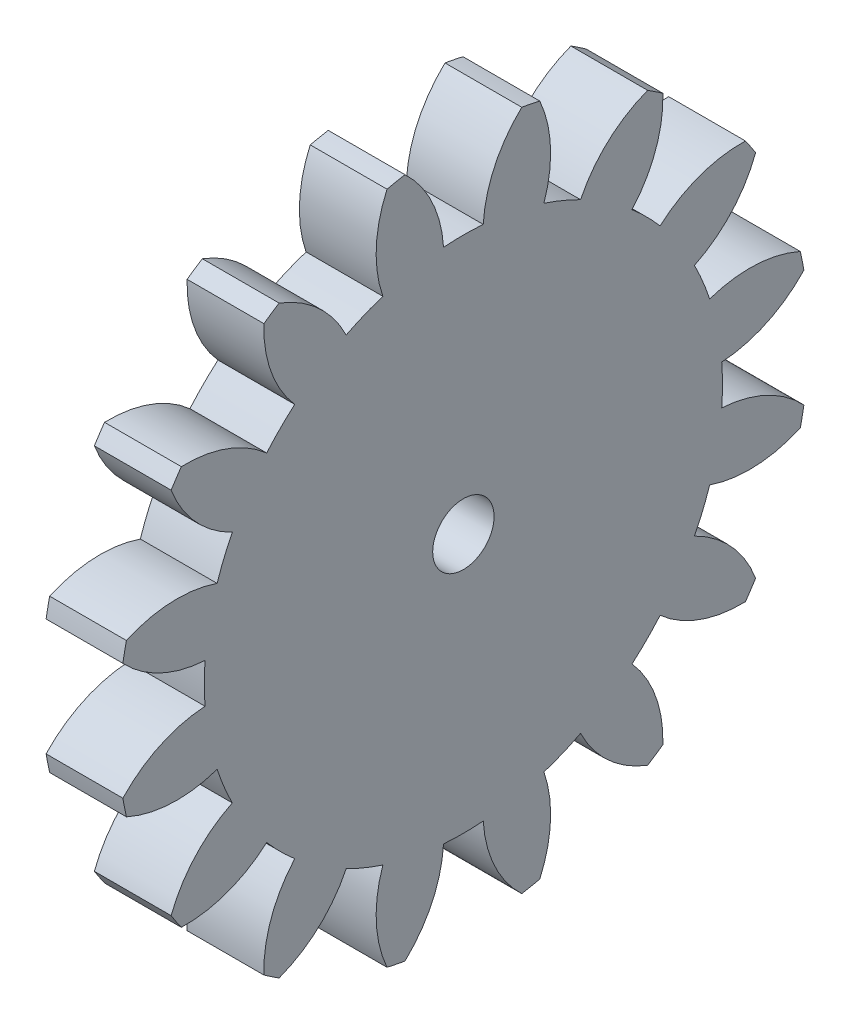
from build123d import *

# Parameters (mm, degrees)
BASPROSKE_W      = 10
BASPROSKE_H      = 45
TOOTHCUT_DEPTH   = 65.420493634
TEETHCUTS_COUNT  = 16
TEETHCUTS_ANGLE  = 337.5
HUBNEAONESKE_R   = 10
HUBNEARONE_DEPTH = 10.0000508
BORSKE_R         = 4
BORE_DEPTH       = 20.0000508


with BuildPart() as part:
    # BasProSke → Base-Revolve (revolve)
    with BuildSketch(Plane(origin=(0, 0, 0), x_dir=(1, 0, 0), z_dir=(0, 1, 0)), mode=Mode.PRIVATE) as base_revolve_sk:
        with Locations((5, 22.5)):
            Rectangle(BASPROSKE_W, BASPROSKE_H)
    revolve(base_revolve_sk.sketch.rotate(Axis((-10, 0, 0), (1, 0, 0)), 180), axis=Axis((-10, 0, 0), (1, 0, 0)))

    # TooCutSke → ToothCut (cut, through all)
    with BuildSketch(Plane(origin=(0, 0, 0), x_dir=(0, 0, -1), z_dir=(1, 0, 0))):
        with BuildLine():
            ThreePointArc((2.585211293, 33.64983928), (0, 33.749), (-2.585211293, 33.64983928))
            ThreePointArc((-2.585211293, 33.64983928), (-4.077113604, 39.496303475), (-7.62816215, 44.37451732))
            ThreePointArc((-7.62816215, 44.37451732), (0, 45.0254), (7.62816215, 44.37451732))
            ThreePointArc((7.62816215, 44.37451732), (4.077113604, 39.496303475), (2.585211293, 33.64983928))
        make_face()
    toothcut = extrude(amount=TOOTHCUT_DEPTH, mode=Mode.SUBTRACT)

    # TeethCuts: ToothCut ×16 about axis
    teethcuts_axis = Axis((-10, 0, 0), (1, 0, 0))
    for i in range(1, TEETHCUTS_COUNT):
        add(toothcut.rotate(teethcuts_axis, i * TEETHCUTS_ANGLE / (TEETHCUTS_COUNT - 1)), mode=Mode.SUBTRACT)

    # HubNeaOneSke → HubNearOne (add)
    with BuildSketch(Plane.ZY):
        with Locations(Location((0, 0, 0), (0, 0, 180))):
            Circle(HUBNEAONESKE_R)
    extrude(amount=HUBNEARONE_DEPTH)

    # BorSke → Bore (cut, symmetric)
    with BuildSketch(Plane(origin=(0, 0, 0), x_dir=(0, 0, -1), z_dir=(1, 0, 0))):
        with Locations(Location((0, 0, 0), (0, 0, 180))):
            Circle(BORSKE_R)
    extrude(amount=BORE_DEPTH, both=True, mode=Mode.SUBTRACT)


solid = part.part
